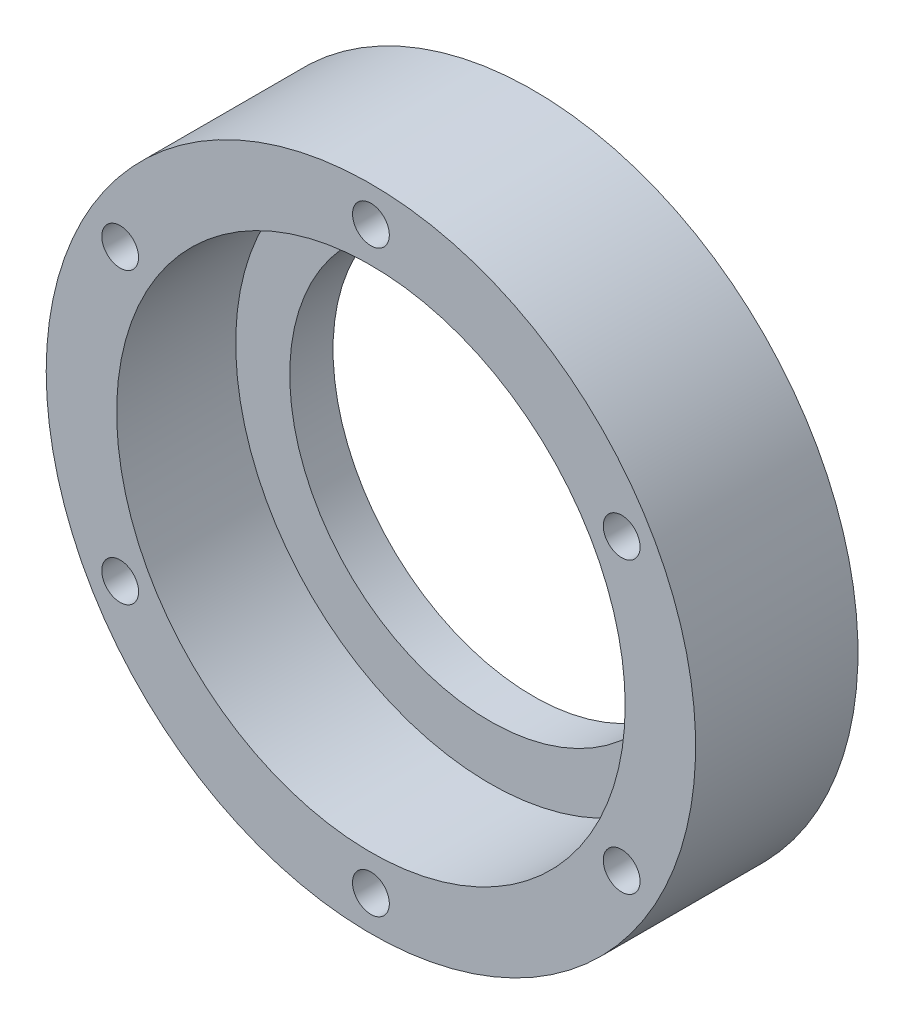
from build123d import *

# Parameters (mm, degrees)
SKETCH1_W             = 30
SKETCH1_H             = 15
F_4_CLEARANCE_HOLE1_D = 3.4
HOLE1_D               = 37
HOLE1_CBORE_D         = 46.98238
HOLE1_CBORE_DEPTH     = 11
CHAMFER1_SIZE         = 1.45


with BuildPart() as part:
    # Sketch1 → Revolve1 (revolve)
    with BuildSketch(Plane.XZ, mode=Mode.PRIVATE) as revolve1_sk:
        with Locations((15, 7.5)):
            Rectangle(SKETCH1_W, SKETCH1_H)
    revolve(revolve1_sk.sketch.rotate(Axis((0, 0, 15), (0, 0, -1)), 180), axis=Axis((0, 0, 15), (0, 0, -1)))

    # #4 Clearance Hole1 (through all)
    with Locations(Plane(origin=(0, 0, 0), x_dir=(-1, 0, 0), z_dir=(0, 0, -1))):
        with Locations((-23.166179551, -13.375), (-23.166179551, 13.375), (0, 26.75), (23.166179551, -13.375), (0, -26.75), (23.166179551, 13.375)):
            Hole(F_4_CLEARANCE_HOLE1_D / 2)

    # Hole1 (through all)
    with Locations(Plane.XY.offset(15)):
        with Locations((0, 0)):
            CounterBoreHole(HOLE1_D / 2, HOLE1_CBORE_D / 2, HOLE1_CBORE_DEPTH)

    # Chamfer1
    chamfer1_edges = [part.edges().sort_by_distance(p)[0] for p in [
        (-24.866179551, 13.375, 0),
        (-1.7, -26.75, 0),
        (-24.866179551, -13.375, 0),
        (-1.7, 26.75, 0),
        (21.466179551, 13.375, 0),
        (21.466179551, -13.375, 0),
    ]]
    chamfer(chamfer1_edges, length=CHAMFER1_SIZE)


solid = part.part
